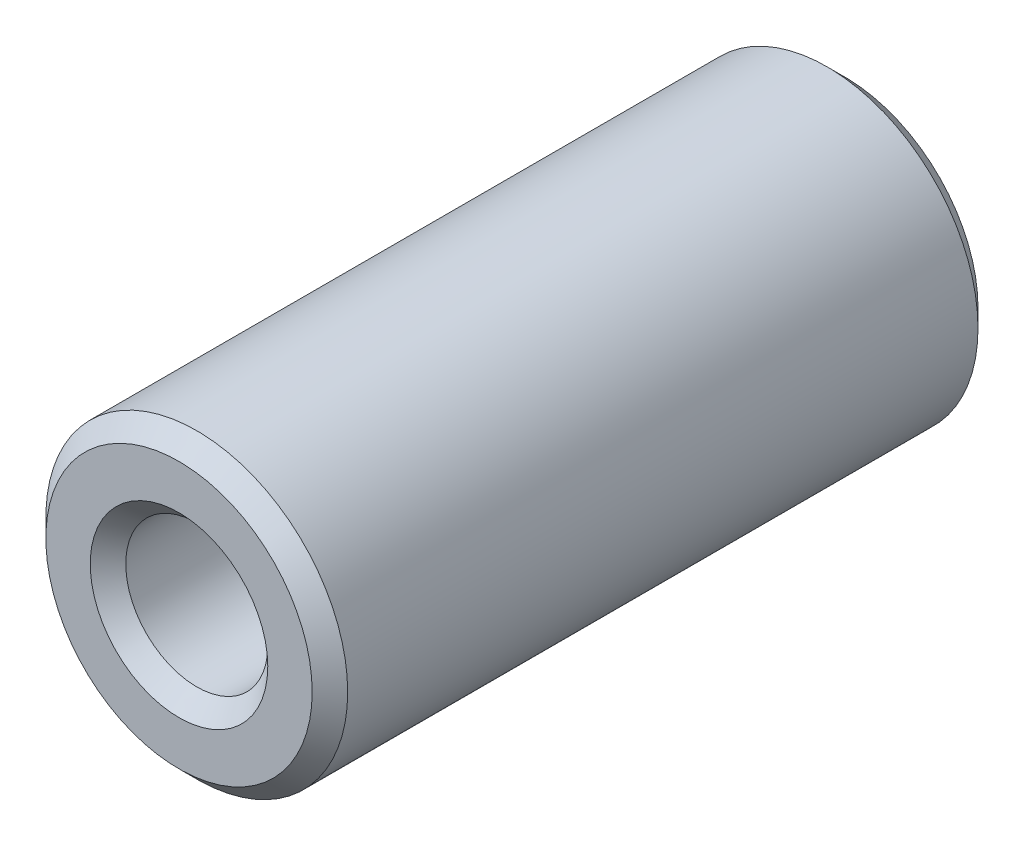
from build123d import *

# Parameters (mm, degrees)
SKETCH_1_R      = 17
SKETCH_1_R_2    = 8
EXTRUDE_1_DEPTH = 75
CHAMFER_1_SIZE  = 2


with BuildPart() as part:
    # Эскиз1 → Бобышка-Вытянуть1 (new body)
    with BuildSketch(Plane.XY):
        Circle(SKETCH_1_R)
        Circle(SKETCH_1_R_2, mode=Mode.SUBTRACT)
    extrude(amount=EXTRUDE_1_DEPTH)

    # Фаска1
    chamfer_1_edges = [part.edges().sort_by_distance(p)[0] for p in [
        (-17, 0, 0),
        (-17, 0, 75),
        (-8, 0, 0),
        (-8, 0, 75),
    ]]
    chamfer(chamfer_1_edges, length=CHAMFER_1_SIZE)


solid = part.part
